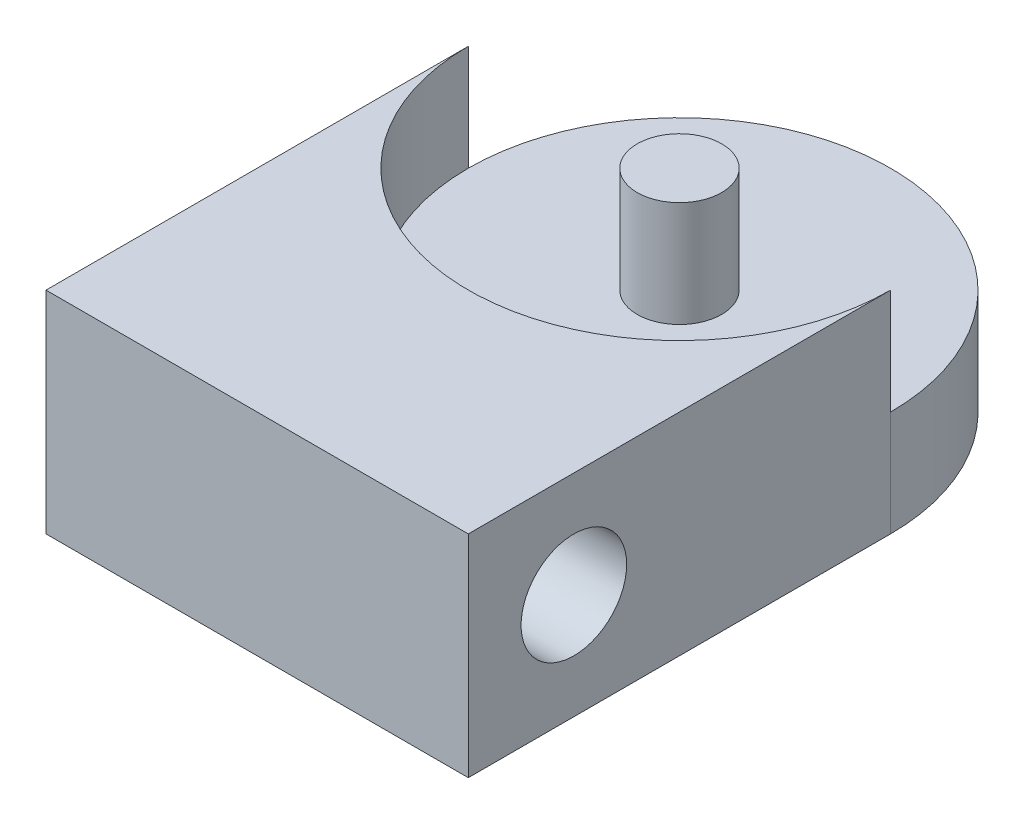
from build123d import *

# Parameters (mm, degrees)
AUFSATZ_LINEAR_AUSTRAGEN1_DEPTH = 5
SKIZZE2_R                       = 2
AUFSATZ_LINEAR_AUSTRAGEN2_DEPTH = 5
SKIZZE3_R                       = 2.5
SCHNITT_LINEAR_AUSTRAGEN1_DEPTH = 31


with BuildPart() as part:
    # Skizze1 → Aufsatz-Linear austragen1 (new body)
    with BuildSketch(Plane(origin=(0, 0, 0), x_dir=(1, 0, 0), z_dir=(0, 1, 0))):
        with BuildLine():
            ThreePointArc((10, 0), (0, 10), (-10, 0))
            Line((-10, 0), (10, 0))
        make_face()
        with BuildLine():
            Line((10, 0), (-10, 0))
            ThreePointArc((-10, 0), (0, -10), (10, 0))
        make_face()
        with BuildLine():
            ThreePointArc((10, 0), (0, 10), (-10, 0))
            Line((-10, 0), (10, 0))
        make_face()
        with BuildLine():
            Line((10, 0), (-10, 0))
            ThreePointArc((-10, 0), (0, -10), (10, 0))
        make_face()
        with BuildLine():
            ThreePointArc((10, 0), (0, -10), (-10, 0))
            Line((-10, 0), (-10, -20))
            Line((-10, -20), (10, -20))
            Line((10, -20), (10, 0))
        make_face()
    extrude(amount=AUFSATZ_LINEAR_AUSTRAGEN1_DEPTH)

    # Skizze2 → Aufsatz-Linear austragen2 (add)
    with BuildSketch(Plane(origin=(0, 5, 0), x_dir=(1, 0, 0), z_dir=(0, 1, 0))):
        with Locations(Location((0, 0, 0), (0, 0, 270))):
            Circle(SKIZZE2_R)
        with BuildLine():
            Line((-10, -20), (10, -20))
            Line((10, -20), (10, 0))
            ThreePointArc((10, 0), (0, -10), (-10, 0))
            Line((-10, 0), (-10, -20))
        make_face()
    extrude(amount=AUFSATZ_LINEAR_AUSTRAGEN2_DEPTH)

    # Skizze3 → Schnitt-Linear austragen1 (cut, through all)
    with BuildSketch(Plane(origin=(10, 0, 0), x_dir=(0, 0, -1), z_dir=(1, 0, 0))):
        with Locations((-15, 5)):
            Circle(SKIZZE3_R)
    extrude(amount=-SCHNITT_LINEAR_AUSTRAGEN1_DEPTH, mode=Mode.SUBTRACT)


solid = part.part
